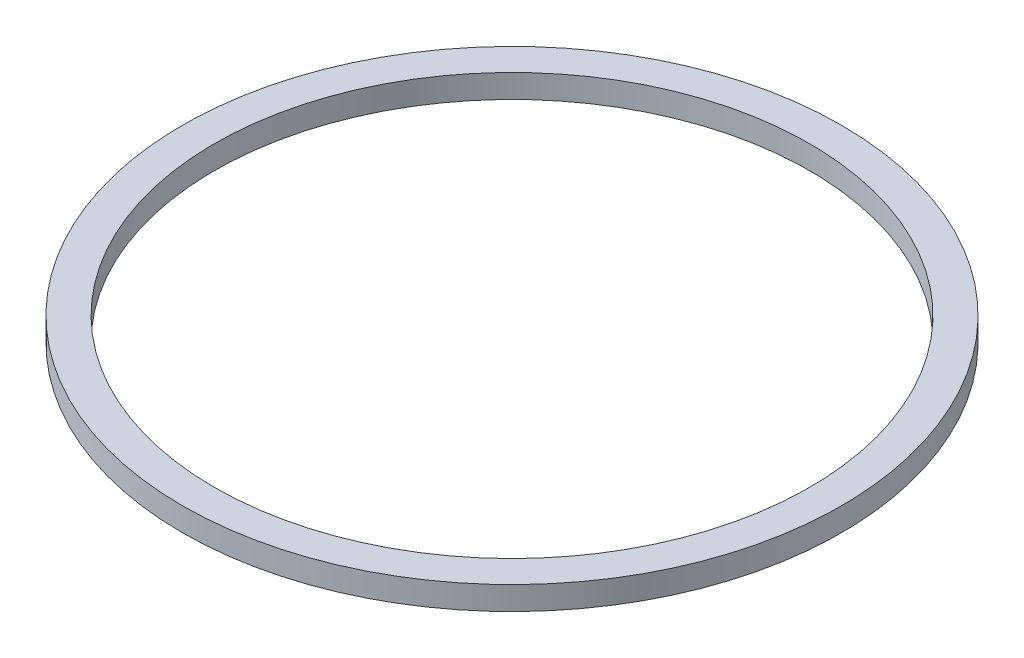
from build123d import *

# Parameters (mm, degrees)
SKETCH1_R           = 15.5
SKETCH1_R_2         = 14
BOSS_EXTRUDE1_DEPTH = 1.1


with BuildPart() as part:
    # Sketch1 → Boss-Extrude1 (new body)
    with BuildSketch(Plane(origin=(0, 0, 0), x_dir=(1, 0, 0), z_dir=(0, 1, 0))):
        with Locations(Location((0, 0, 0), (0, 0, 270))):
            Circle(SKETCH1_R)
        with Locations(Location((0, 0, 0), (0, 0, 270))):
            Circle(SKETCH1_R_2, mode=Mode.SUBTRACT)
    extrude(amount=BOSS_EXTRUDE1_DEPTH)


solid = part.part
